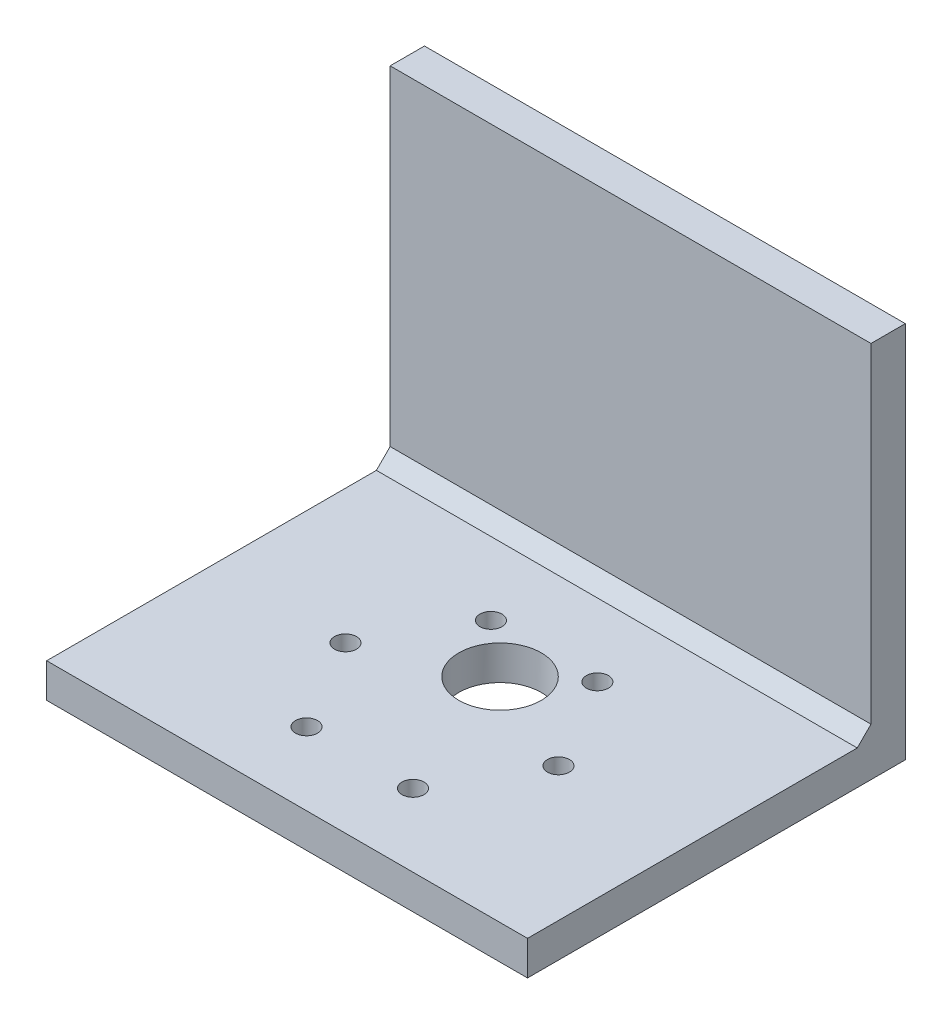
from build123d import *

# Parameters (mm, degrees)
SZKIC2_W                    = 70
SZKIC2_H                    = 50
DODANIE_WYCI_GNI_CIE1_DEPTH = 5
OTW_R_3_2_3_2_1_D           = 3.2
OTW_R_3_2_3_2_1_DEPTH       = 5
OTW_R_3_2_3_2_1_TIP         = 0.96137699
WYTNIJ_WYCI_GNI_CIE1_REACH  = 45.301
SZKIC7_R                    = 6
DODANIE_WYCI_GNI_CIE2_DEPTH = 5
SFAZOWANIE1_SIZE            = 2


with BuildPart() as part:
    # Szkic2 → Dodanie-wyciągnięcie1 (new body)
    with BuildSketch(Plane(origin=(0, 0, 0), x_dir=(1, 0, 0), z_dir=(0, 1, 0))):
        Rectangle(SZKIC2_W, SZKIC2_H)
    extrude(amount=DODANIE_WYCI_GNI_CIE1_DEPTH)

    # Otwór Ø3.2 (3.2)1
    with Locations(Plane(origin=(0, 5, 0), x_dir=(1, 0, 0), z_dir=(0, 1, 0))):
        with Locations((-7.75, -14.423393759), (7.75, -14.423393759), (15.5, -1), (7.75, 12.423393759), (-7.75, 12.423393759), (-15.5, -1)):
            Hole(OTW_R_3_2_3_2_1_D / 2, depth=OTW_R_3_2_3_2_1_DEPTH)
            with Locations((0, 0, -(OTW_R_3_2_3_2_1_DEPTH + OTW_R_3_2_3_2_1_TIP / 2))):  # 118° drill point
                Cone(0, OTW_R_3_2_3_2_1_D / 2, OTW_R_3_2_3_2_1_TIP, mode=Mode.SUBTRACT)

    # Szkic7 → Wytnij-wyciągnięcie1 (cut, up to next)
    with BuildSketch(Plane(origin=(0, 5, 0), x_dir=(1, 0, 0), z_dir=(0, 1, 0)), mode=Mode.PRIVATE) as wytnij_wyci_gni_cie1_sk1:
        with Locations(Location((0, 6, 0), (0, 0, 270))):
            Circle(SZKIC7_R)
    wytnij_wyci_gni_cie1_tool1 = extrude(wytnij_wyci_gni_cie1_sk1.sketch, amount=-WYTNIJ_WYCI_GNI_CIE1_REACH, mode=Mode.PRIVATE) & part.part
    add(wytnij_wyci_gni_cie1_tool1.solids().sort_by_distance((0, 5, -6))[0], mode=Mode.SUBTRACT)

    # Szkic8 → Dodanie-wyciągnięcie2 (add)
    with BuildSketch(Plane(origin=(0, 0, -25), x_dir=(-1, 0, 0), z_dir=(0, 0, -1))):
        Polygon((-35, 5), (-35, 55), (35, 55), (35, 5), (35, 0), (-35, 0), align=None)
    extrude(amount=DODANIE_WYCI_GNI_CIE2_DEPTH)

    # Sfazowanie1
    sfazowanie1_edges = [part.edges().sort_by_distance(p)[0] for p in [
        (0, 5, -25),
    ]]
    chamfer(sfazowanie1_edges, length=SFAZOWANIE1_SIZE)


solid = part.part
